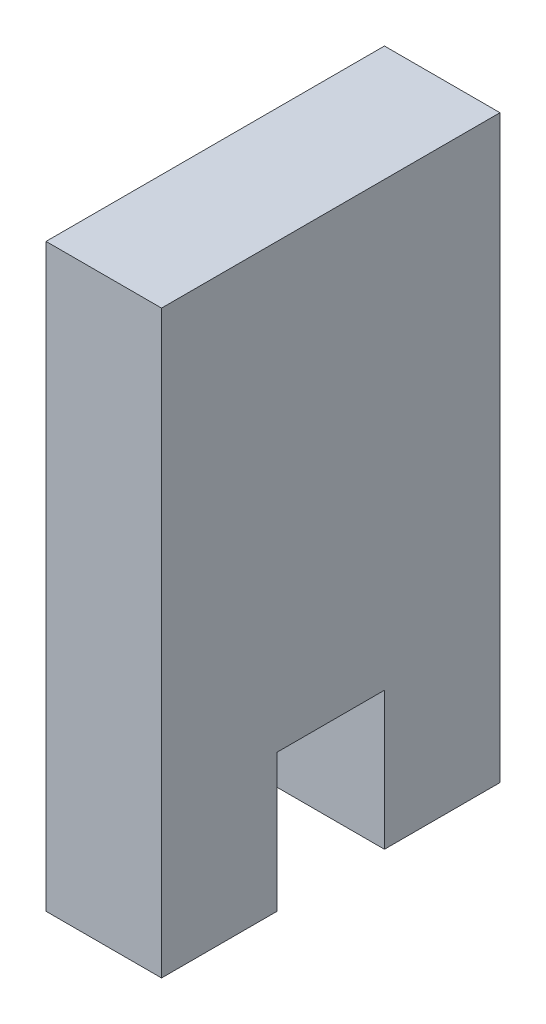
from build123d import *

# Parameters (mm, degrees)
BOSS_EXTRUDE1_DEPTH = 6.35


with BuildPart() as part:
    # Sketch1 → Boss-Extrude1 (new body)
    with BuildSketch(Plane(origin=(0, 0, 0), x_dir=(0, 0, -1), z_dir=(1, 0, 0))):
        Polygon((0, 0), (6.35, 0), (6.35, 7.573414721), (12.253982435, 7.573414721), (12.253982435, 0), (18.603982435, 0), (18.603982435, 31.892541318), (0, 31.892541318), align=None)
    extrude(amount=BOSS_EXTRUDE1_DEPTH)


solid = part.part
